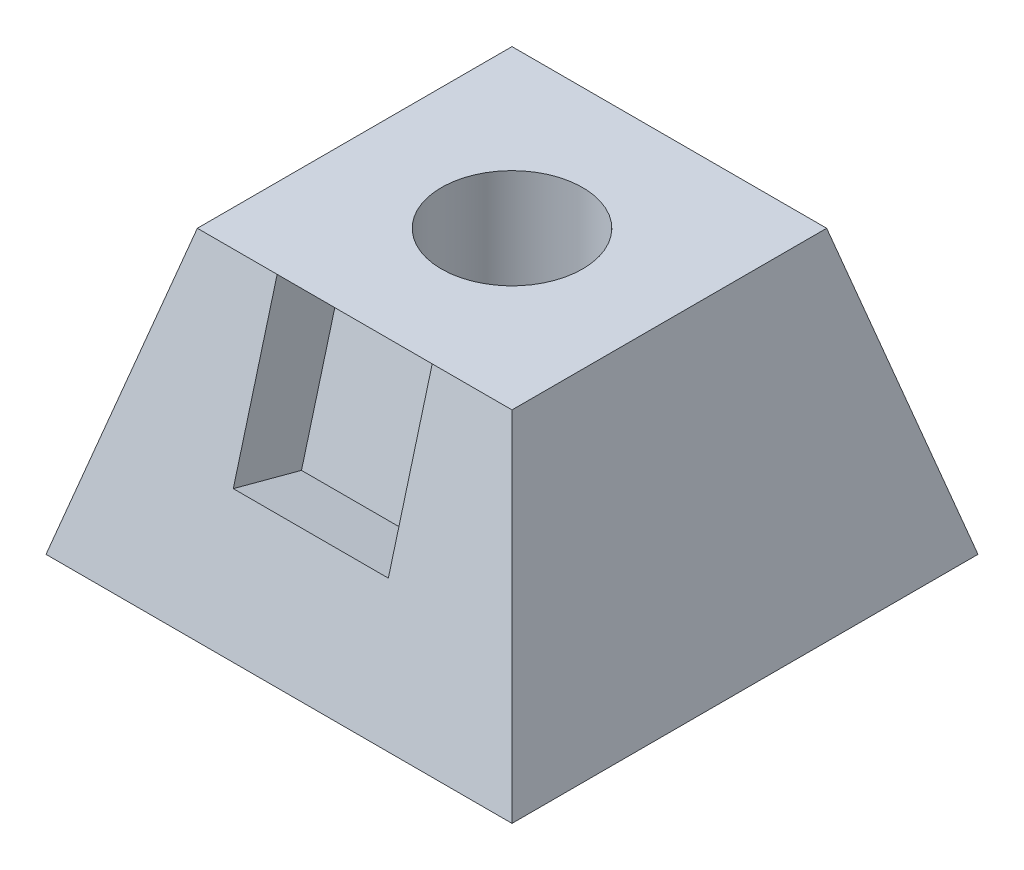
from build123d import *

# Parameters (mm, degrees)
SKETCH1_W           = 330
SKETCH1_H           = 330
BOSS_EXTRUDE1_DEPTH = 200
BOSS_EXTRUDE1_TAPER = 15
SKETCH2_R           = 50
CUT_EXTRUDE1_DEPTH  = 170
SKETCH7_W           = 109.8
SKETCH7_H           = 120
CUT_EXTRUDE2_DEPTH  = 50


with BuildPart() as part:
    # Sketch1 → Boss-Extrude1 (new body)
    with BuildSketch(Plane(origin=(0, 0, 0), x_dir=(1, 0, 0), z_dir=(0, 1, 0))):
        Rectangle(SKETCH1_W, SKETCH1_H)
    extrude(amount=BOSS_EXTRUDE1_DEPTH, taper=BOSS_EXTRUDE1_TAPER)

    # Sketch2 → Cut-Extrude1 (cut)
    with BuildSketch(Plane(origin=(0, 200, 0), x_dir=(1, 0, 0), z_dir=(0, 1, 0))):
        with Locations(Location((0, 0, 0), (0, 0, 270))):
            Circle(SKETCH2_R)
    extrude(amount=-CUT_EXTRUDE1_DEPTH, mode=Mode.SUBTRACT)

    # Sketch7 → Cut-Extrude2 (cut)
    with BuildSketch(Plane(origin=(0, 41.25, 153.947095812), x_dir=(1, 0, 0), z_dir=(0, 0.2588190451025208, 0.9659258262890682))):
        with Locations((0, 104.35009364)):
            Rectangle(SKETCH7_W, SKETCH7_H)
    extrude(amount=-CUT_EXTRUDE2_DEPTH, mode=Mode.SUBTRACT)


solid = part.part
